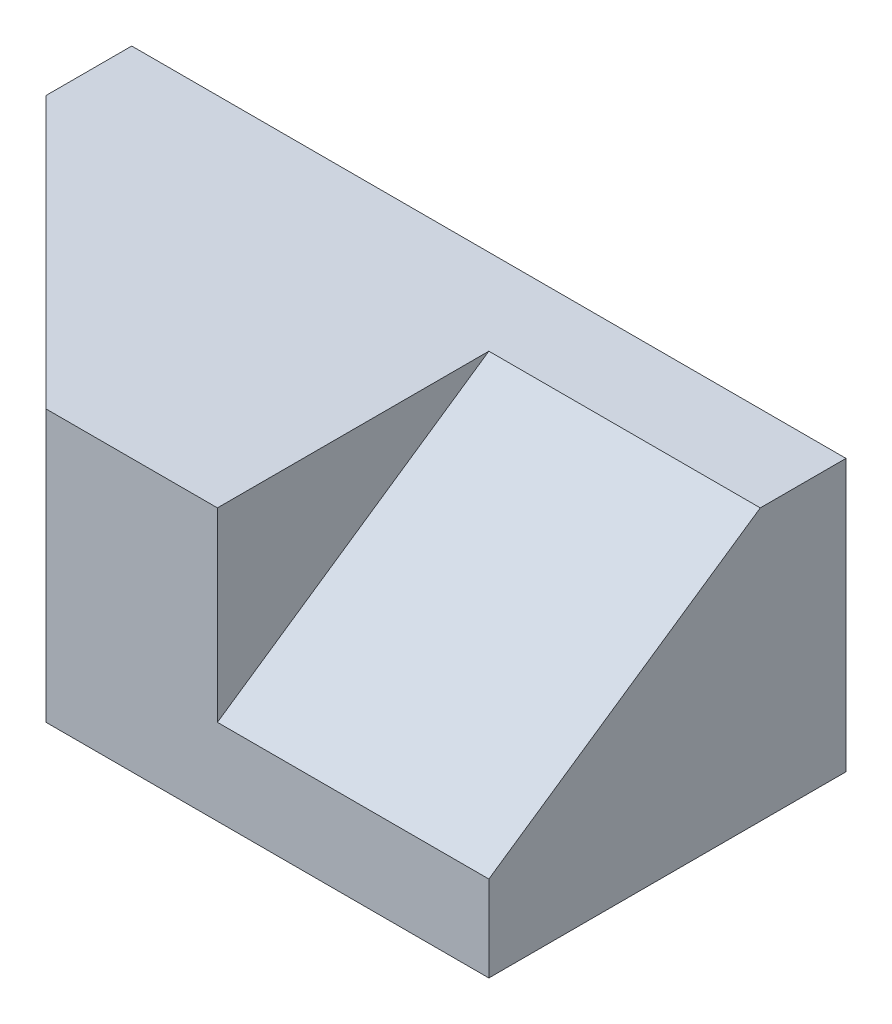
from build123d import *

# Parameters (mm, degrees)
BOSS_EXTRUDE1_DEPTH = 38
CUT_EXTRUDE1_DEPTH  = 38


with BuildPart() as part:
    # Sketch1 → Boss-Extrude1 (new body)
    with BuildSketch(Plane(origin=(0, 0, 0), x_dir=(1, 0, 0), z_dir=(0, 1, 0))):
        Polygon((0, 0), (0, -12), (38, -50), (100, -50), (100, 0), align=None)
    extrude(amount=BOSS_EXTRUDE1_DEPTH)

    # Sketch2 → Cut-Extrude1 (cut)
    with BuildSketch(Plane(origin=(100, 0, 0), x_dir=(0, 0, -1), z_dir=(1, 0, 0))):
        Polygon((-12, 38), (-50, 12), (-50, 38), align=None)
    extrude(amount=-CUT_EXTRUDE1_DEPTH, mode=Mode.SUBTRACT)


solid = part.part
